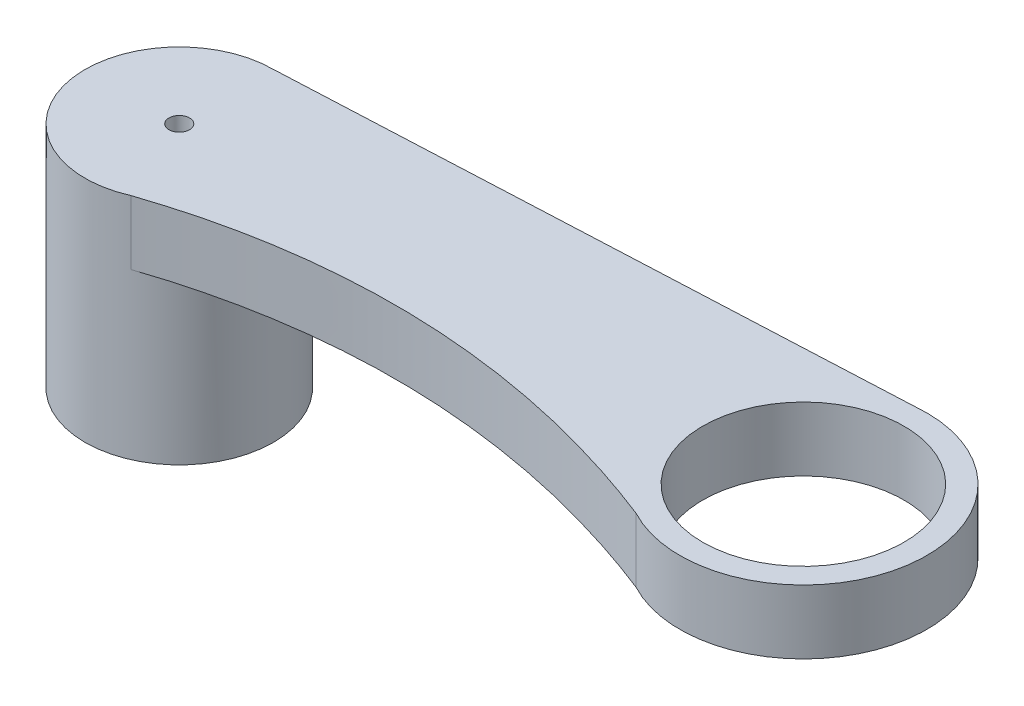
from build123d import *

# Parameters (mm, degrees)
SZKIC1_R                    = 10.3
DODANIE_WYCI_GNI_CIE1_DEPTH = 25
OTWORY_USTALAJ_CE_2_5MM2_D  = 2.25
DODANIE_WYCI_GNI_CIE3_START = -7
DODANIE_WYCI_GNI_CIE3_DEPTH = 7
OTWORY_USTALAJ_CE_2_5MM3_D  = 22


with BuildPart() as part:
    # Szkic1 → Dodanie-wyciągnięcie1 (new body)
    with BuildSketch(Plane(origin=(0, 0, 0), x_dir=(1, 0, 0), z_dir=(0, 1, 0))):
        with Locations(Location((0, 0, 0), (0, 0, 270))):
            Circle(SZKIC1_R)
    extrude(amount=DODANIE_WYCI_GNI_CIE1_DEPTH)

    # Otwory ustalające Ø2.5mm2 (through all)
    with Locations(Plane.XZ):
        with Locations((0, 0)):
            Hole(OTWORY_USTALAJ_CE_2_5MM2_D / 2)

    # Szkic7 → Dodanie-wyciągnięcie3 (add)
    with BuildSketch(Plane(origin=(0, 25, 0), x_dir=(1, 0, 0), z_dir=(0, 1, 0)).offset(DODANIE_WYCI_GNI_CIE3_START)):
        with BuildLine():
            Line((66.943357066, 13.440701035), (0, 10.3))
            ThreePointArc((0, 10.3), (10.077130906, 2.131063748), (4.169904535, -9.418168408))
            add(Edge.make_bspline(
                [(4.169904535, -9.418168408), (22.461776037, -3.24596138), (41.934151815, -4.077243057), (61.820006497, -11.893378905)],
                knots=[0, 0, 0, 0, 1, 1, 1, 1], degree=3))
            ThreePointArc((61.820006497, -11.893378905), (81.439431711, -2.675954354), (66.943357066, 13.440701035))
        make_face()
    extrude(amount=DODANIE_WYCI_GNI_CIE3_DEPTH)

    # Otwory ustalające Ø2.5mm3 (through all)
    with Locations(Plane(origin=(0, 25, 0), x_dir=(1, 0, 0), z_dir=(0, 1, 0))):
        with Locations((68.207301561, 0)):
            Hole(OTWORY_USTALAJ_CE_2_5MM3_D / 2)


solid = part.part
